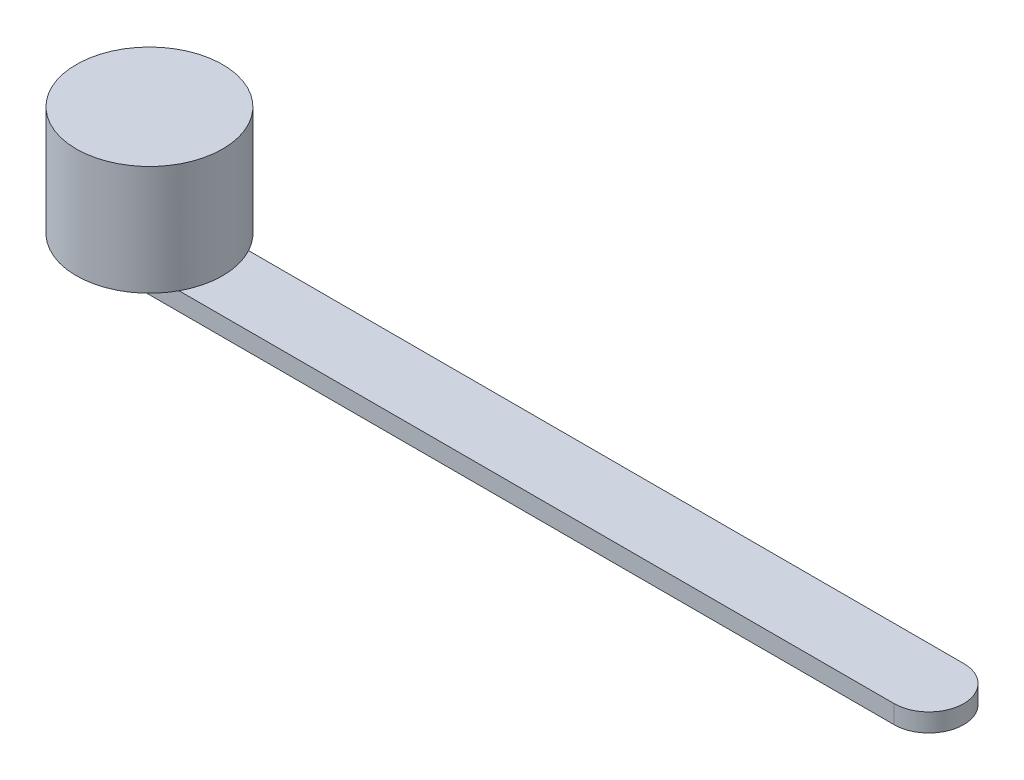
from build123d import *

# Parameters (mm, degrees)
BOSS_EXTRUDE1_DEPTH     = 2.5
SKETCH2_R               = 10
BOSS_EXTRUDE2_DEPTH     = 15
CUT_EXTRUDE1_DEPTH      = 101.496505017
CUT_EXTRUDE1_DEPTH_BACK = 2.5
SKETCH3_R               = 7.5
BOSS_EXTRUDE3_START     = 2.5
SKETCH4_R               = 7.5
BOSS_EXTRUDE3_DEPTH     = 2.5


with BuildPart() as part:
    # Sketch1 → Boss-Extrude1 (new body)
    with BuildSketch(Plane(origin=(0, 0, 0), x_dir=(1, 0, 0), z_dir=(0, 1, 0))):
        with BuildLine():
            Line((-18.295454545, 4.75), (93.704545455, 4.75))
            ThreePointArc((93.704545455, 4.75), (98.454545455, 0), (93.704545455, -4.75))
            Line((93.704545455, -4.75), (-18.295454545, -4.75))
            ThreePointArc((-18.295454545, -4.75), (-23.045454545, 0), (-18.295454545, 4.75))
        make_face()
    extrude(amount=BOSS_EXTRUDE1_DEPTH)

    # Sketch2 → Boss-Extrude2 (add)
    with BuildSketch(Plane(origin=(0, 2.5, 0), x_dir=(1, 0, 0), z_dir=(0, 1, 0))):
        with Locations(Location((-12.795454545, 0, 0), (0, 0, 28.359350028))):
            Circle(SKETCH2_R)
    extrude(amount=BOSS_EXTRUDE2_DEPTH)

    # Sketch3 → Cut-Extrude1 (cut, two sides: drawn at the far end of the back side and taken through both)
    with BuildSketch(Plane(origin=(0, 17.5, 0), x_dir=(1, 0, 0), z_dir=(0, 1, 0)).offset(-CUT_EXTRUDE1_DEPTH_BACK)):
        with Locations(Location((-12.795454545, 0, 0), (0, 0, 90))):
            Circle(SKETCH3_R)
    extrude(amount=CUT_EXTRUDE1_DEPTH + CUT_EXTRUDE1_DEPTH_BACK, mode=Mode.SUBTRACT)

    # Sketch4 → Boss-Extrude3 (add)
    with BuildSketch(Plane(origin=(0, 15, 0), x_dir=(1, 0, 0), z_dir=(0, 1, 0)).offset(BOSS_EXTRUDE3_START)):
        with Locations((-12.795454545, 0)):
            Circle(SKETCH4_R)
    extrude(amount=-BOSS_EXTRUDE3_DEPTH)


solid = part.part
